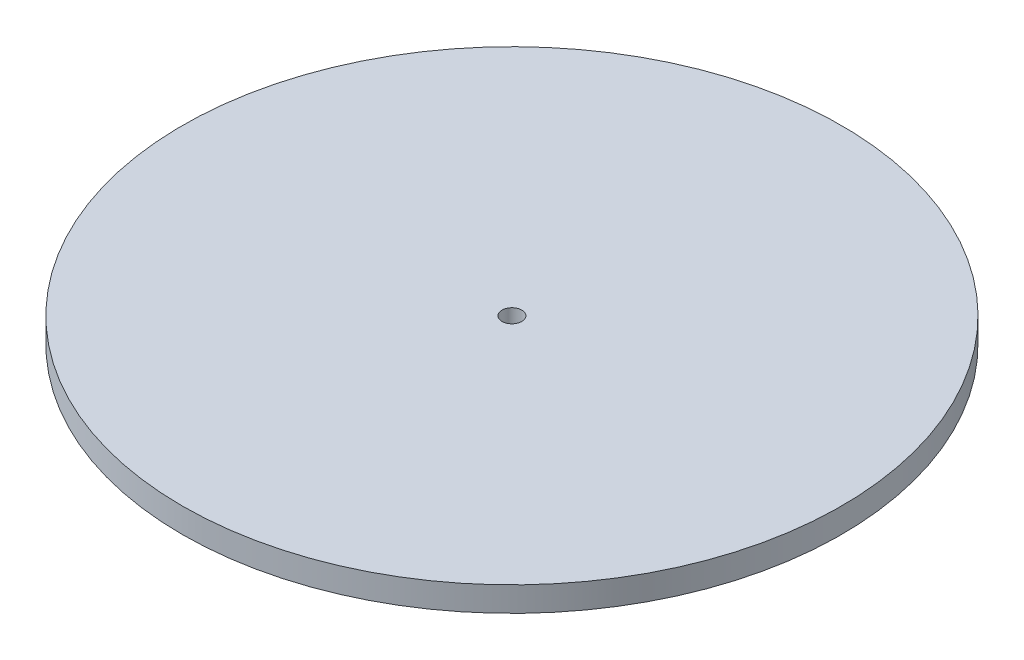
from build123d import *

# Parameters (mm, degrees)
SKETCH5_R          = 1.2
CUT_EXTRUDE1_DEPTH = 63.330265321


with BuildPart() as part:
    # Sketch3 → Revolve4 (revolve)
    with BuildSketch(Plane.XY, mode=Mode.PRIVATE) as revolve4_sk:
        with BuildLine():
            Line((1.2, 26.173688502), (1.2, 21.173688502))
            Line((1.2, 21.173688502), (0, 21.173688502))
            Line((0, 21.173688502), (0, 0))
            add(Edge.make_bspline(
                [(0, 0), (4.62500003, 0.363539266), (9.249999976, 7.509330177), (13.875000027, 6.131858732), (18.499999969, 13.632838145), (23.125000008, 13.194256588), (27.749999988, 17.609451873), (32.374999998, 19.583652691), (37, 22.173688502)],
                knots=[0.075275782, 0.075275782, 0.075275782, 0.075275782, 0.075275782, 0.075275782, 0.075275782, 0.075275782, 0.075275782, 0.918512168, 0.918512168, 0.918512168, 0.918512168, 0.918512168, 0.918512168, 0.918512168, 0.918512168, 0.918512168], degree=8))
            Line((37, 22.173688502), (37, 23.173688502))
            Line((37, 23.173688502), (40, 23.173688502))
            Line((40, 23.173688502), (40, 26.173688502))
            Line((40, 26.173688502), (1.2, 26.173688502))
        make_face()
    revolve(revolve4_sk.sketch.rotate(Axis((0, 26.173688502, 0), (0, -1, 0)), 90), axis=Axis((0, 26.173688502, 0), (0, -1, 0)))

    # Sketch5 → Cut-Extrude1 (cut, through all)
    with BuildSketch(Plane(origin=(0, 26.173688502, 0), x_dir=(1, 0, 0), z_dir=(0, 1, 0))):
        with Locations(Location((0, 0, 0), (0, 0, 270))):
            Circle(SKETCH5_R)
    extrude(amount=-CUT_EXTRUDE1_DEPTH, mode=Mode.SUBTRACT)


solid = part.part
